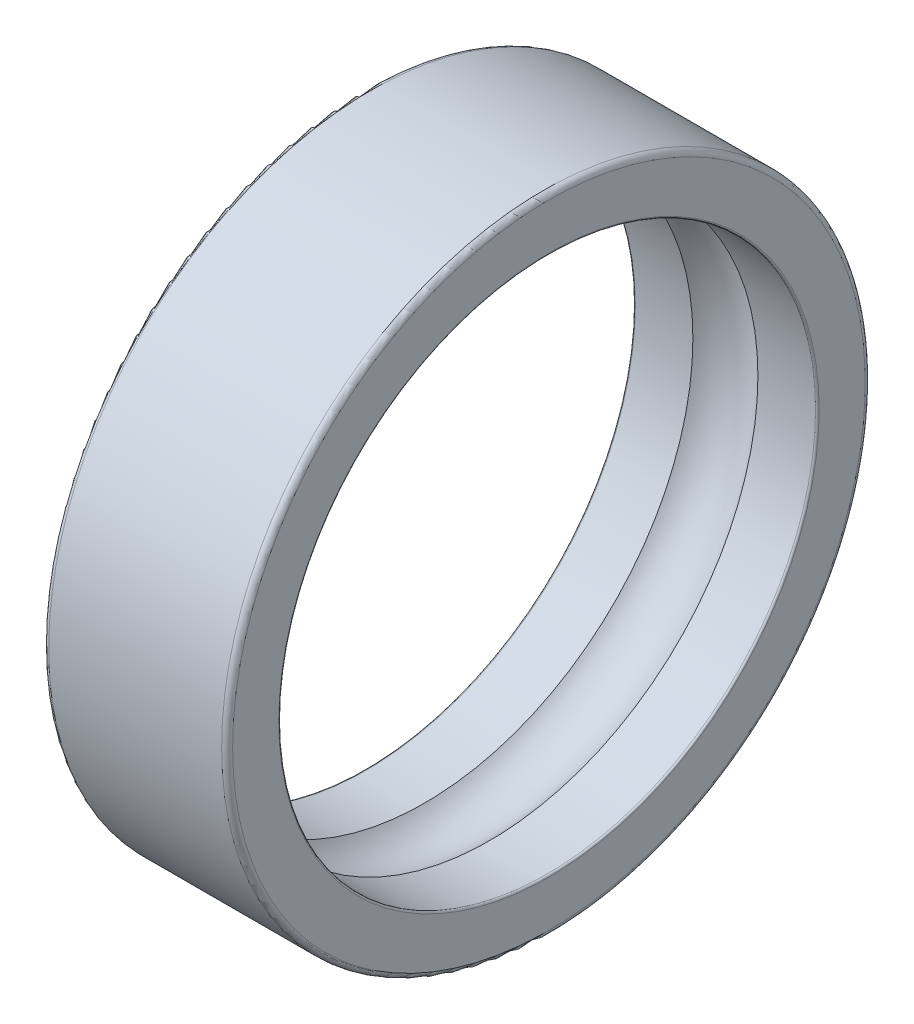
from build123d import *


with BuildPart() as part:
    # Esquisse1 → Révolution1 (revolve)
    with BuildSketch(Plane.XY, mode=Mode.PRIVATE) as r_volution1_sk:
        with BuildLine():
            Line((0, 17.2), (0, 14.695))
            ThreePointArc((0, 14.695), (0.029289322, 14.624289322), (0.1, 14.595))
            Line((0.1, 14.595), (3.232194581, 14.595))
            ThreePointArc((3.232194581, 14.595), (5, 15.381), (6.767805419, 14.595))
            Line((6.767805419, 14.595), (9.9, 14.595))
            ThreePointArc((9.9, 14.595), (9.970710678, 14.624289322), (10, 14.695))
            Line((10, 14.695), (10, 17.2))
            ThreePointArc((10, 17.2), (9.912132034, 17.412132034), (9.7, 17.5))
            Line((9.7, 17.5), (0.3, 17.5))
            ThreePointArc((0.3, 17.5), (0.087867966, 17.412132034), (0, 17.2))
        make_face()
    revolve(r_volution1_sk.sketch.rotate(Axis((50, 0, 0), (-1, 0, 0)), 270), axis=Axis((50, 0, 0), (-1, 0, 0)))


solid = part.part
